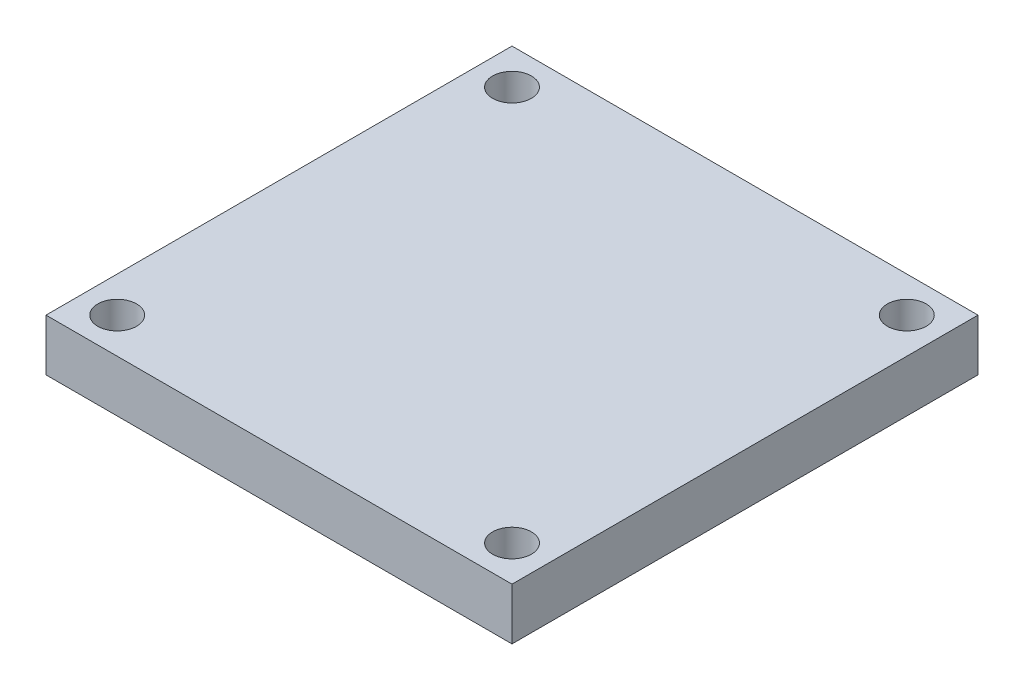
from build123d import *

# Parameters (mm, degrees)
SKETCH1_W                   = 36
SKETCH1_H                   = 36
BOSS_EXTRUDE1_DEPTH         = 4
F_3_0MM_PRESS_DOWEL_HOLE1_D = 3


with BuildPart() as part:
    # Sketch1 → Boss-Extrude1 (new body)
    with BuildSketch(Plane(origin=(0, 0, 0), x_dir=(1, 0, 0), z_dir=(0, 1, 0))):
        Rectangle(SKETCH1_W, SKETCH1_H)
    extrude(amount=BOSS_EXTRUDE1_DEPTH)

    # Ø3.0mm Press Dowel Hole1 (through all)
    with Locations(Plane(origin=(0, 4, 0), x_dir=(1, 0, 0), z_dir=(0, 1, 0))):
        with Locations((-15.25, 15.25), (15.25, 15.25), (15.25, -15.25), (-15.25, -15.25)):
            Hole(F_3_0MM_PRESS_DOWEL_HOLE1_D / 2)


solid = part.part
